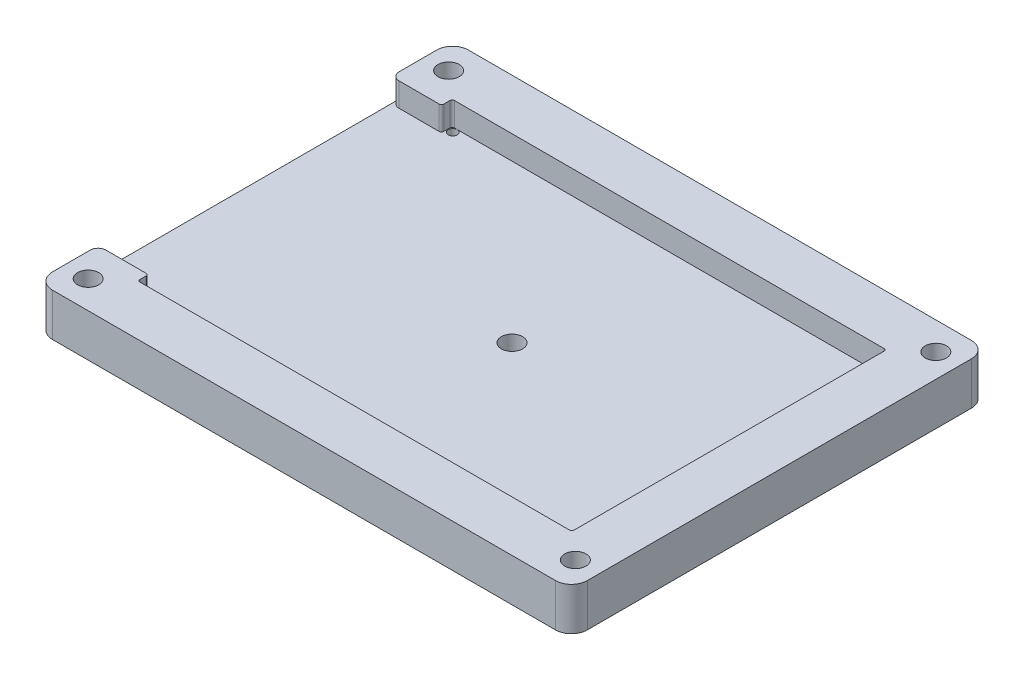
from build123d import *

# Parameters (mm, degrees)
SKETCH1_W                = 85.725
SKETCH1_H                = 66.675
BOSS_EXTRUDE1_DEPTH      = 6.858
FILLET1_R                = 2.54
SKETCH2_W                = 69.596
SKETCH2_H                = 50.419
CUT_EXTRUDE1_DEPTH       = 3.81
FILLET2_R                = 0.381
SKETCH3_R                = 0.7239
CUT_EXTRUDE2_DEPTH       = 3.556
M3_CLEARANCE_HOLE1_D     = 3.4
M3_CLEARANCE_HOLE1_DEPTH = 6.858
SKETCH6_W                = 46.393114838
SKETCH6_H                = 46.99
CUT_EXTRUDE3_DEPTH       = 3.81
FILLET3_R                = 0.381
FILLET4_R                = 1.27


with BuildPart() as part:
    # Sketch1 → Boss-Extrude1 (new body)
    with BuildSketch(Plane(origin=(0, 0, 0), x_dir=(1, 0, 0), z_dir=(0, 1, 0))):
        Rectangle(SKETCH1_W, SKETCH1_H)
    extrude(amount=BOSS_EXTRUDE1_DEPTH)

    # Fillet1
    fillet1_edges = [part.edges().sort_by_distance(p)[0] for p in [
        (42.8625, 3.429, 33.3375),
        (-42.8625, 3.429, 33.3375),
        (-42.8625, 3.429, -33.3375),
        (42.8625, 3.429, -33.3375),
    ]]
    fillet(fillet1_edges, radius=FILLET1_R)

    # Sketch2 → Cut-Extrude1 (cut)
    with BuildSketch(Plane(origin=(0, 6.858, 0), x_dir=(1, 0, 0), z_dir=(0, 1, 0))):
        Rectangle(SKETCH2_W, SKETCH2_H)
    extrude(amount=-CUT_EXTRUDE1_DEPTH, mode=Mode.SUBTRACT)

    # Fillet2
    fillet2_edges = [part.edges().sort_by_distance(p)[0] for p in [
        (-34.798, 4.953, 25.2095),
        (-34.798, 4.953, -25.2095),
        (34.798, 4.953, -25.2095),
        (34.798, 4.953, 25.2095),
    ]]
    fillet(fillet2_edges, radius=FILLET2_R)

    # Sketch3 → Cut-Extrude2 (cut)
    with BuildSketch(Plane(origin=(0, 3.048, 0), x_dir=(1, 0, 0), z_dir=(0, 1, 0))):
        with Locations(Location((-33.9725, 24.4729, 0), (0, 0, 270))):
            Circle(SKETCH3_R)
        with Locations(Location((33.9725, 24.4729, 0), (0, 0, 270))):
            Circle(SKETCH3_R)
        with Locations(Location((33.9725, -24.4729, 0), (0, 0, 270))):
            Circle(SKETCH3_R)
        with Locations(Location((-33.9725, -24.4729, 0), (0, 0, 270))):
            Circle(SKETCH3_R)
    extrude(amount=-CUT_EXTRUDE2_DEPTH, mode=Mode.SUBTRACT)

    # M3 Clearance Hole1
    with Locations(Plane(origin=(0, 0, 0), x_dir=(-1, 0, 0), z_dir=(0, -1, 0))):
        with Locations((-39.0525, 28.8925), (0, 0), (39.0525, 28.8925), (-39.0525, -28.8925), (39.0525, -28.8925)):
            Hole(M3_CLEARANCE_HOLE1_D / 2, depth=M3_CLEARANCE_HOLE1_DEPTH)

    # Sketch6 → Cut-Extrude3 (cut)
    with BuildSketch(Plane(origin=(0, 6.858, 0), x_dir=(1, 0, 0), z_dir=(0, 1, 0))):
        with Locations((-42.86502452, 0)):
            Rectangle(SKETCH6_W, SKETCH6_H)
    extrude(amount=-CUT_EXTRUDE3_DEPTH, mode=Mode.SUBTRACT)

    # Fillet3
    fillet3_edges = [part.edges().sort_by_distance(p)[0] for p in [
        (-34.798, 4.953, -23.495),
        (-34.798, 4.953, 23.495),
    ]]
    fillet(fillet3_edges, radius=FILLET3_R)

    # Fillet4
    fillet4_edges = [part.edges().sort_by_distance(p)[0] for p in [
        (-42.8625, 4.953, -23.495),
        (-42.8625, 4.953, 23.495),
    ]]
    fillet(fillet4_edges, radius=FILLET4_R)


solid = part.part
